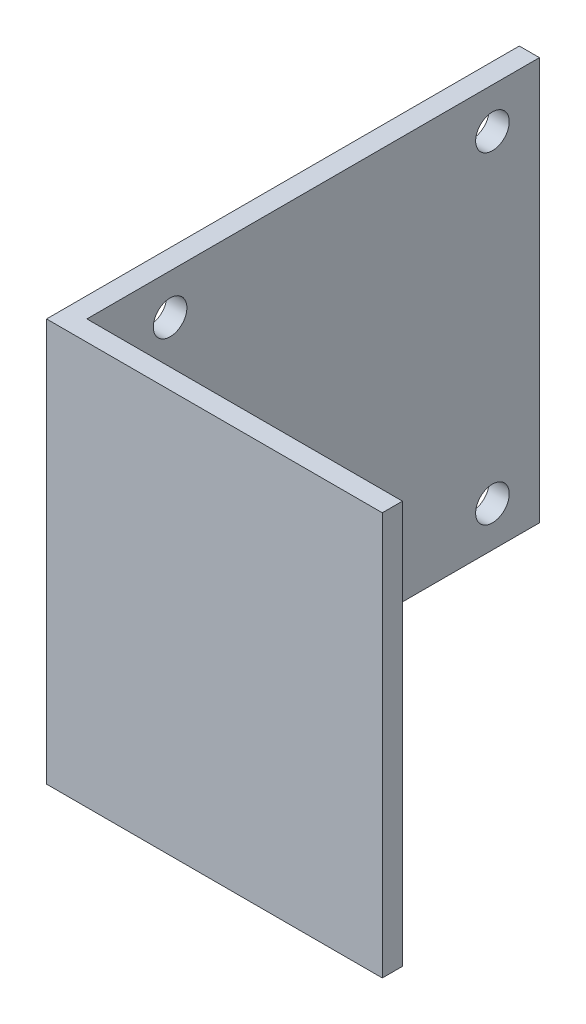
from build123d import *

# Parameters (mm, degrees)
BOSS_EXTRUDE1_DEPTH = 60
SKETCH2_R           = 2.5
CUT_EXTRUDE1_DEPTH  = 106.148276258


with BuildPart() as part:
    # Sketch1 → Boss-Extrude1 (new body)
    with BuildSketch(Plane(origin=(0, 0, 0), x_dir=(1, 0, 0), z_dir=(0, 1, 0))):
        Polygon((0, 0), (0, 70.4), (3, 70.4), (3, 3), (50, 3), (50, 0), align=None)
    extrude(amount=BOSS_EXTRUDE1_DEPTH)

    # Sketch2 → Cut-Extrude1 (cut, through all)
    with BuildSketch(Plane.ZY):
        with Locations((-63.4, 6)):
            Circle(SKETCH2_R)
        with Locations((-15.4, 6)):
            Circle(SKETCH2_R)
        with Locations((-15.4, 54)):
            Circle(SKETCH2_R)
        with Locations((-63.4, 54)):
            Circle(SKETCH2_R)
    extrude(amount=-CUT_EXTRUDE1_DEPTH, mode=Mode.SUBTRACT)


solid = part.part
